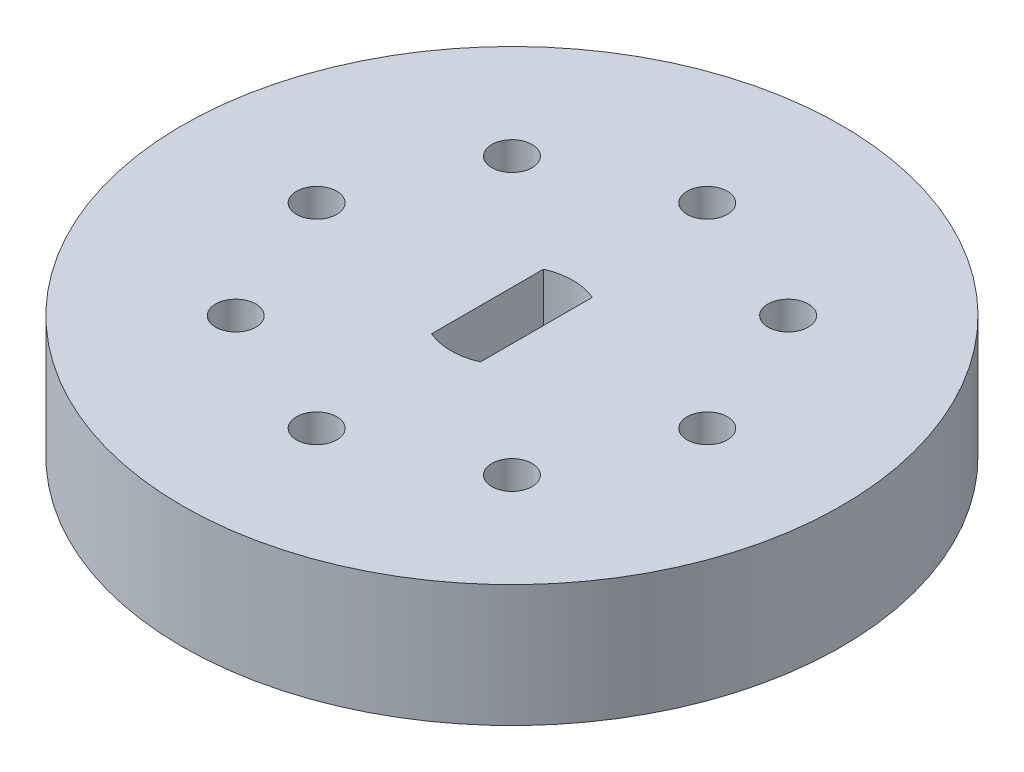
from build123d import *

# Parameters (mm, degrees)
SKETCH1_R           = 27
BOSS_EXTRUDE1_DEPTH = 10
CUT_EXTRUDE1_DEPTH  = 10
SKETCH3_R           = 1.65
CUT_EXTRUDE2_DEPTH  = 10


with BuildPart() as part:
    # Sketch1 → Boss-Extrude1 (new body)
    with BuildSketch(Plane(origin=(0, 0, 0), x_dir=(1, 0, 0), z_dir=(0, 1, 0))):
        with Locations(Location((0, 0, 0), (0, 0, 270))):
            Circle(SKETCH1_R)
    extrude(amount=BOSS_EXTRUDE1_DEPTH)

    # Sketch2 → Cut-Extrude1 (cut)
    with BuildSketch(Plane(origin=(0, 10, 0), x_dir=(1, 0, 0), z_dir=(0, 1, 0))):
        with BuildLine():
            Line((-2, 4.582575695), (-2, -4.582575695))
            ThreePointArc((-2, -4.582575695), (0, -5), (2, -4.582575695))
            Line((2, -4.582575695), (2, 4.582575695))
            ThreePointArc((2, 4.582575695), (0, 5), (-2, 4.582575695))
        make_face()
    extrude(amount=-CUT_EXTRUDE1_DEPTH, mode=Mode.SUBTRACT)

    # Sketch3 → Cut-Extrude2 (cut)
    with BuildSketch(Plane(origin=(0, 10, 0), x_dir=(1, 0, 0), z_dir=(0, 1, 0))):
        with Locations(Location((16, 0, 0), (0, 0, 270))):
            Circle(SKETCH3_R)
        with Locations(Location((11.313708499, -11.313708499, 0), (0, 0, 270))):
            Circle(SKETCH3_R)
        with Locations(Location((0, -16, 0), (0, 0, 270))):
            Circle(SKETCH3_R)
        with Locations(Location((-11.313708499, -11.313708499, 0), (0, 0, 270))):
            Circle(SKETCH3_R)
        with Locations(Location((-16, 0, 0), (0, 0, 270))):
            Circle(SKETCH3_R)
        with Locations(Location((-11.313708499, 11.313708499, 0), (0, 0, 270))):
            Circle(SKETCH3_R)
        with Locations(Location((0, 16, 0), (0, 0, 270))):
            Circle(SKETCH3_R)
        with Locations(Location((11.313708499, 11.313708499, 0), (0, 0, 270))):
            Circle(SKETCH3_R)
    extrude(amount=-CUT_EXTRUDE2_DEPTH, mode=Mode.SUBTRACT)


solid = part.part
